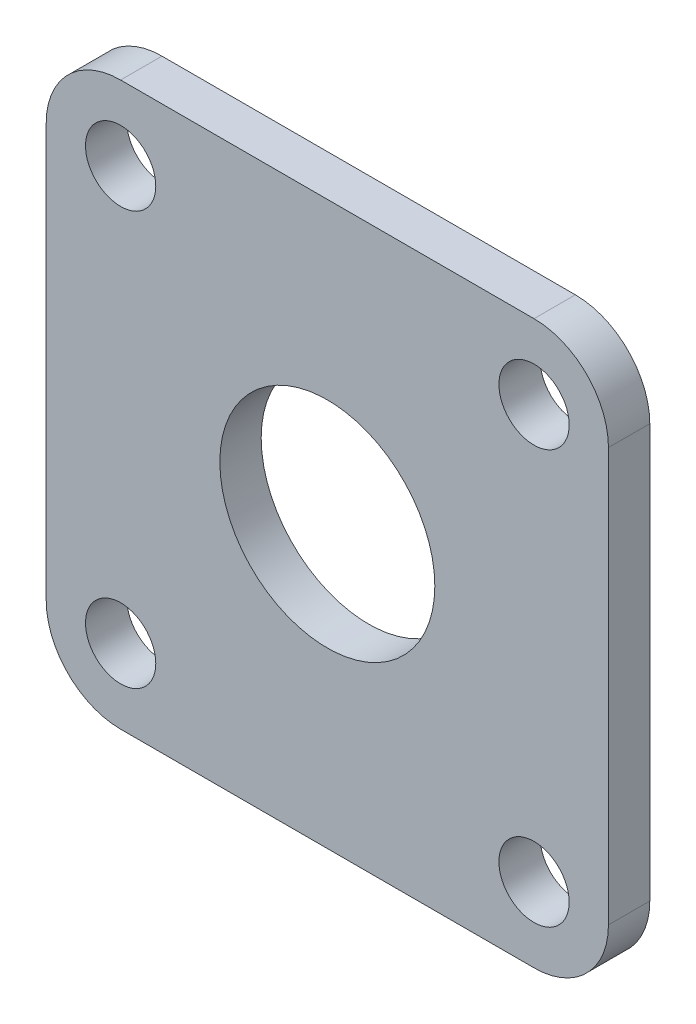
from build123d import *

# Parameters (mm, degrees)
CROQUIS1_R              = 4.25
CROQUIS1_R_2            = 13
SALIENTE_EXTRUIR1_DEPTH = 5


with BuildPart() as part:
    # Croquis1 → Saliente-Extruir1 (new body)
    with BuildSketch(Plane.XY):
        with BuildLine():
            Line((25, 34), (-25, 34))
            ThreePointArc((-25, 34), (-31.363961031, 31.363961031), (-34, 25))
            Line((-34, 25), (-34, -25))
            ThreePointArc((-34, -25), (-31.363961031, -31.363961031), (-25, -34))
            Line((-25, -34), (25, -34))
            ThreePointArc((25, -34), (31.363961031, -31.363961031), (34, -25))
            Line((34, -25), (34, 25))
            ThreePointArc((34, 25), (31.363961031, 31.363961031), (25, 34))
        make_face()
        with Locations((-25, 25)):
            Circle(CROQUIS1_R, mode=Mode.SUBTRACT)
        with Locations((-25, -25)):
            Circle(CROQUIS1_R, mode=Mode.SUBTRACT)
        with Locations((25, -25)):
            Circle(CROQUIS1_R, mode=Mode.SUBTRACT)
        with Locations((25, 25)):
            Circle(CROQUIS1_R, mode=Mode.SUBTRACT)
        Circle(CROQUIS1_R_2, mode=Mode.SUBTRACT)
    extrude(amount=SALIENTE_EXTRUIR1_DEPTH)


solid = part.part
